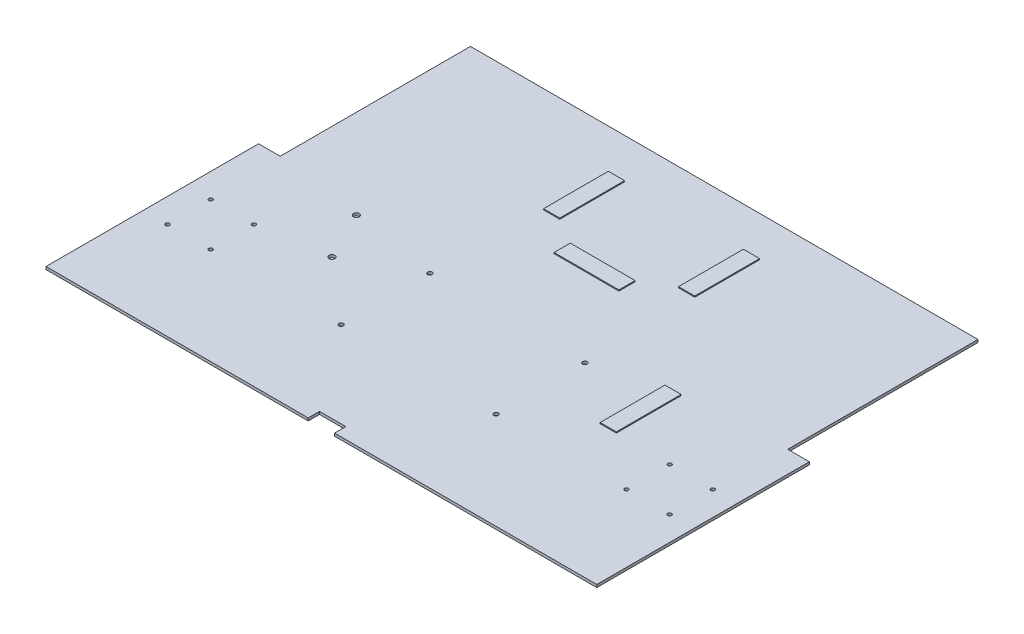
from build123d import *

# Parameters (mm, degrees)
SKETCH1_R           = 2.667
SKETCH1_R_2         = 2.2479
SKETCH1_R_3         = 3.429
BOSS_EXTRUDE1_DEPTH = 1.5875
SKETCH4_W           = 30.98284419
SKETCH4_H           = 26.473645648
CUT_EXTRUDE2_DEPTH  = 402.23458743
SKETCH5_W           = 76.2
SKETCH5_H           = 19.05
SKETCH5_W_2         = 19.05
SKETCH5_H_2         = 76.2
BOSS_EXTRUDE2_DEPTH = 1.27


with BuildPart() as part:
    # Sketch1 → Boss-Extrude1 (new, symmetric)
    with BuildSketch(Plane(origin=(0, 0, 0), x_dir=(1, 0, 0), z_dir=(0, 1, 0))):
        Polygon((-298.45, 13.124176698), (-298.45, 236.855), (298.45, 236.855), (298.45, 13.124176698), (323.85, 13.124176698), (323.85, -236.855), (-323.85, -236.855), (-323.85, 13.124176698), align=None)
        with Locations(Location((91.135199987, -18.161, 0), (0, 0, 270))):
            Circle(SKETCH1_R, mode=Mode.SUBTRACT)
        with Locations(Location((91.135199987, -122.555, 0), (0, 0, 270))):
            Circle(SKETCH1_R, mode=Mode.SUBTRACT)
        with Locations(Location((-91.135199987, -122.555, 0), (0, 0, 270))):
            Circle(SKETCH1_R, mode=Mode.SUBTRACT)
        with Locations(Location((-91.135199987, -18.161, 0), (0, 0, 270))):
            Circle(SKETCH1_R, mode=Mode.SUBTRACT)
        with Locations(Location((-295.275, -71.755, 0), (0, 0, 270))):
            Circle(SKETCH1_R_2, mode=Mode.SUBTRACT)
        with Locations(Location((-244.475, -71.755, 0), (0, 0, 270))):
            Circle(SKETCH1_R_2, mode=Mode.SUBTRACT)
        with Locations(Location((-244.475, -122.555, 0), (0, 0, 270))):
            Circle(SKETCH1_R_2, mode=Mode.SUBTRACT)
        with Locations(Location((-295.275, -122.555, 0), (0, 0, 270))):
            Circle(SKETCH1_R_2, mode=Mode.SUBTRACT)
        with Locations(Location((295.275, -122.555, 0), (0, 0, 90))):
            Circle(SKETCH1_R_2, mode=Mode.SUBTRACT)
        with Locations(Location((244.475, -122.555, 0), (0, 0, 90))):
            Circle(SKETCH1_R_2, mode=Mode.SUBTRACT)
        with Locations(Location((244.475, -71.755, 0), (0, 0, 90))):
            Circle(SKETCH1_R_2, mode=Mode.SUBTRACT)
        with Locations(Location((295.275, -71.755, 0), (0, 0, 90))):
            Circle(SKETCH1_R_2, mode=Mode.SUBTRACT)
        with Locations(Location((-193.675, -2.042328148, 0), (0, 0, 270))):
            Circle(SKETCH1_R_3, mode=Mode.SUBTRACT)
        with Locations(Location((-165.455833426, -59.055, 0), (0, 0, 270))):
            Circle(SKETCH1_R_3, mode=Mode.SUBTRACT)
    extrude(amount=BOSS_EXTRUDE1_DEPTH, both=True)

    # Sketch4 → Cut-Extrude2 (cut, through all)
    with BuildSketch(Plane(origin=(0, 1.5875, 0), x_dir=(1, 0, 0), z_dir=(0, 1, 0))):
        with Locations((0, -236.855)):
            Rectangle(SKETCH4_W, SKETCH4_H)
    extrude(amount=-CUT_EXTRUDE2_DEPTH, mode=Mode.SUBTRACT)

    # Sketch5 → Boss-Extrude2 (add)
    with BuildSketch(Plane(origin=(0, 1.5875, 0), x_dir=(1, 0, 0), z_dir=(0, 1, 0))):
        with Locations((0, 84.455)):
            Rectangle(SKETCH5_W, SKETCH5_H)
        with Locations((-79.375, 151.421322831)):
            Rectangle(SKETCH5_W_2, SKETCH5_H_2)
        with Locations((79.375, 151.421322831)):
            Rectangle(SKETCH5_W_2, SKETCH5_H_2)
        with Locations((171.623795352, -33.052997334)):
            Rectangle(SKETCH5_W_2, SKETCH5_H_2)
    extrude(amount=BOSS_EXTRUDE2_DEPTH)


solid = part.part
